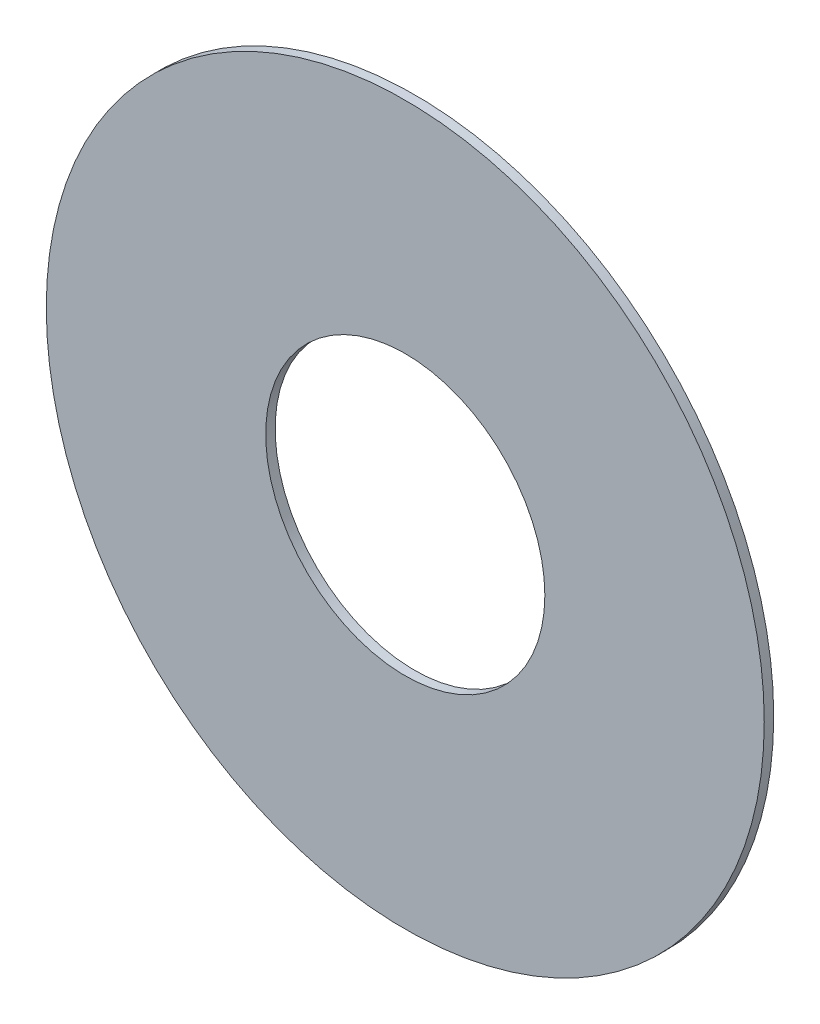
from build123d import *

# Parameters (mm, degrees)
PRINTED_GUARD_START = 40.5
SKETCH_1_R          = 75.876923077
SKETCH_1_R_2        = 29.5
PRINTED_GUARD_DEPTH = 2


with BuildPart() as part:
    # Эскиз1 → Printed_guard (new body)
    with BuildSketch(Plane.XY.offset(PRINTED_GUARD_START)):
        Circle(SKETCH_1_R)
        Circle(SKETCH_1_R_2, mode=Mode.SUBTRACT)
    extrude(amount=PRINTED_GUARD_DEPTH)


solid = part.part
